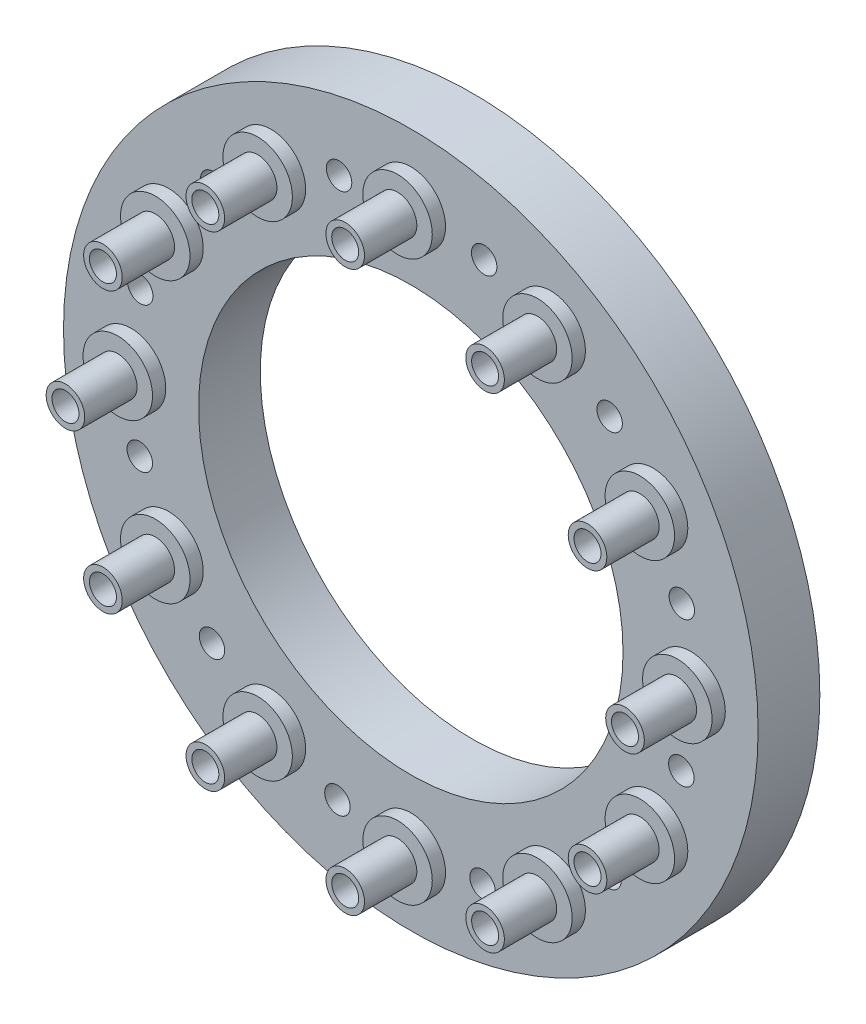
from build123d import *

# Parameters (mm, degrees)
SKETCH1_R            = 180
SKETCH1_R_2          = 110
BOTTOM_ANNULUS_DEPTH = 10
SKETCH3_R            = 180
SKETCH3_R_2          = 110
ANNULUS_PLENUM_DEPTH = 12
SKETCH4_R            = 180
SKETCH4_R_2          = 110
TOP_ANNULUS_DEPTH    = 10
SKETCH8_R            = 6.6
CUT_EXTRUDE1_DEPTH   = 75
SKETCH6_R            = 18
SKETCH6_R_2          = 10
BOSS_EXTRUDE6_DEPTH  = 6.871206759
SKETCH10_R           = 10
SKETCH10_R_2         = 7
BOSS_EXTRUDE7_DEPTH  = 33.989306272


with BuildPart() as part:
    # Sketch1 → Bottom Annulus (new body)
    with BuildSketch(Plane.XY):
        Circle(SKETCH1_R)
        Circle(SKETCH1_R_2, mode=Mode.SUBTRACT)
    extrude(amount=BOTTOM_ANNULUS_DEPTH)

    # Sketch3 → Annulus Plenum (add)
    with BuildSketch(Plane.XY.offset(10)):
        Circle(SKETCH3_R)
        Circle(SKETCH3_R_2, mode=Mode.SUBTRACT)
    extrude(amount=ANNULUS_PLENUM_DEPTH)

    # Sketch4 → Top annulus (add)
    with BuildSketch(Plane.XY.offset(22)):
        Circle(SKETCH4_R)
        Circle(SKETCH4_R_2, mode=Mode.SUBTRACT)
    extrude(amount=TOP_ANNULUS_DEPTH)

    # Sketch8 → Cut-Extrude1 (cut)
    with BuildSketch(Plane.XY.offset(32)):
        with Locations((-37.181108248, 140.450646422)):
            Circle(SKETCH8_R)
        with Locations((38.025538928, 140.224381904)):
            Circle(SKETCH8_R)
        with Locations((103.043273656, 102.425107495)):
            Circle(SKETCH8_R)
        with Locations((140.450646422, 37.181108248)):
            Circle(SKETCH8_R)
        with Locations((140.224381904, -38.025538928)):
            Circle(SKETCH8_R)
        with Locations((102.425107495, -103.043273656)):
            Circle(SKETCH8_R)
        with Locations((37.181108248, -140.450646422)):
            Circle(SKETCH8_R)
        with Locations((-38.025538928, -140.224381904)):
            Circle(SKETCH8_R)
        with Locations((-103.043273656, -102.425107495)):
            Circle(SKETCH8_R)
        with Locations((-140.450646422, -37.181108248)):
            Circle(SKETCH8_R)
        with Locations((-140.224381904, 38.025538928)):
            Circle(SKETCH8_R)
        with Locations((-102.425107495, 103.043273656)):
            Circle(SKETCH8_R)
    extrude(amount=-CUT_EXTRUDE1_DEPTH, mode=Mode.SUBTRACT)

    # Sketch6 → Boss-Extrude6 (add)
    # profile 1 of 12: a face of its own
    with BuildSketch(Plane.XY.offset(32)):
        with Locations((0, 145)):
            Circle(SKETCH6_R)
        with Locations((0, 145)):
            Circle(SKETCH6_R_2, mode=Mode.SUBTRACT)
    # profile 2 of 12: a face of its own
    with BuildSketch(Plane.XY.offset(32)):
        with Locations((72.5, 125.573683549)):
            Circle(SKETCH6_R)
        with Locations((72.5, 125.573683549)):
            Circle(SKETCH6_R_2, mode=Mode.SUBTRACT)
    # profile 3 of 12: a face of its own
    with BuildSketch(Plane.XY.offset(32)):
        with Locations((125.573683549, 72.5)):
            Circle(SKETCH6_R)
        with Locations((125.573683549, 72.5)):
            Circle(SKETCH6_R_2, mode=Mode.SUBTRACT)
    # profile 4 of 12: a face of its own
    with BuildSketch(Plane.XY.offset(32)):
        with Locations((145, 0)):
            Circle(SKETCH6_R)
        with Locations((145, 0)):
            Circle(SKETCH6_R_2, mode=Mode.SUBTRACT)
    # profile 5 of 12: a face of its own
    with BuildSketch(Plane.XY.offset(32)):
        with Locations((125.573683549, -72.5)):
            Circle(SKETCH6_R)
        with Locations((125.573683549, -72.5)):
            Circle(SKETCH6_R_2, mode=Mode.SUBTRACT)
    # profile 6 of 12: a face of its own
    with BuildSketch(Plane.XY.offset(32)):
        with Locations((72.5, -125.573683549)):
            Circle(SKETCH6_R)
        with Locations((72.5, -125.573683549)):
            Circle(SKETCH6_R_2, mode=Mode.SUBTRACT)
    # profile 7 of 12: a face of its own
    with BuildSketch(Plane.XY.offset(32)):
        with Locations((0, -145)):
            Circle(SKETCH6_R)
        with Locations((0, -145)):
            Circle(SKETCH6_R_2, mode=Mode.SUBTRACT)
    # profile 8 of 12: a face of its own
    with BuildSketch(Plane.XY.offset(32)):
        with Locations((-72.5, -125.573683549)):
            Circle(SKETCH6_R)
        with Locations((-72.5, -125.573683549)):
            Circle(SKETCH6_R_2, mode=Mode.SUBTRACT)
    # profile 9 of 12: a face of its own
    with BuildSketch(Plane.XY.offset(32)):
        with Locations((-125.573683549, -72.5)):
            Circle(SKETCH6_R)
        with Locations((-125.573683549, -72.5)):
            Circle(SKETCH6_R_2, mode=Mode.SUBTRACT)
    # profile 10 of 12: a face of its own
    with BuildSketch(Plane.XY.offset(32)):
        with Locations((-145, 0)):
            Circle(SKETCH6_R)
        with Locations((-145, 0)):
            Circle(SKETCH6_R_2, mode=Mode.SUBTRACT)
    # profile 11 of 12: a face of its own
    with BuildSketch(Plane.XY.offset(32)):
        with Locations((-125.573683549, 72.5)):
            Circle(SKETCH6_R)
        with Locations((-125.573683549, 72.5)):
            Circle(SKETCH6_R_2, mode=Mode.SUBTRACT)
    # profile 12 of 12: a face of its own
    with BuildSketch(Plane.XY.offset(32)):
        with Locations((-72.5, 125.573683549)):
            Circle(SKETCH6_R)
        with Locations((-72.5, 125.573683549)):
            Circle(SKETCH6_R_2, mode=Mode.SUBTRACT)
    extrude(amount=BOSS_EXTRUDE6_DEPTH)

    # Sketch10 → Boss-Extrude7 (add)
    # profile 1 of 12: a face of its own
    with BuildSketch(Plane.XY.offset(32)):
        with Locations((0, 145)):
            Circle(SKETCH10_R)
        with Locations((0, 145)):
            Circle(SKETCH10_R_2, mode=Mode.SUBTRACT)
    # profile 2 of 12: a face of its own
    with BuildSketch(Plane.XY.offset(32)):
        with Locations((72.5, 125.573683549)):
            Circle(SKETCH10_R)
        with Locations((72.5, 125.573683549)):
            Circle(SKETCH10_R_2, mode=Mode.SUBTRACT)
    # profile 3 of 12: a face of its own
    with BuildSketch(Plane.XY.offset(32)):
        with Locations((125.573683549, 72.5)):
            Circle(SKETCH10_R)
        with Locations((125.573683549, 72.5)):
            Circle(SKETCH10_R_2, mode=Mode.SUBTRACT)
    # profile 4 of 12: a face of its own
    with BuildSketch(Plane.XY.offset(32)):
        with Locations((145, 0)):
            Circle(SKETCH10_R)
        with Locations((145, 0)):
            Circle(SKETCH10_R_2, mode=Mode.SUBTRACT)
    # profile 5 of 12: a face of its own
    with BuildSketch(Plane.XY.offset(32)):
        with Locations((125.573683549, -72.5)):
            Circle(SKETCH10_R)
        with Locations((125.573683549, -72.5)):
            Circle(SKETCH10_R_2, mode=Mode.SUBTRACT)
    # profile 6 of 12: a face of its own
    with BuildSketch(Plane.XY.offset(32)):
        with Locations((72.5, -125.573683549)):
            Circle(SKETCH10_R)
        with Locations((72.5, -125.573683549)):
            Circle(SKETCH10_R_2, mode=Mode.SUBTRACT)
    # profile 7 of 12: a face of its own
    with BuildSketch(Plane.XY.offset(32)):
        with Locations((0, -145)):
            Circle(SKETCH10_R)
        with Locations((0, -145)):
            Circle(SKETCH10_R_2, mode=Mode.SUBTRACT)
    # profile 8 of 12: a face of its own
    with BuildSketch(Plane.XY.offset(32)):
        with Locations((-72.5, -125.573683549)):
            Circle(SKETCH10_R)
        with Locations((-72.5, -125.573683549)):
            Circle(SKETCH10_R_2, mode=Mode.SUBTRACT)
    # profile 9 of 12: a face of its own
    with BuildSketch(Plane.XY.offset(32)):
        with Locations((-125.573683549, -72.5)):
            Circle(SKETCH10_R)
        with Locations((-125.573683549, -72.5)):
            Circle(SKETCH10_R_2, mode=Mode.SUBTRACT)
    # profile 10 of 12: a face of its own
    with BuildSketch(Plane.XY.offset(32)):
        with Locations((-145, 0)):
            Circle(SKETCH10_R)
        with Locations((-145, 0)):
            Circle(SKETCH10_R_2, mode=Mode.SUBTRACT)
    # profile 11 of 12: a face of its own
    with BuildSketch(Plane.XY.offset(32)):
        with Locations((-125.573683549, 72.5)):
            Circle(SKETCH10_R)
        with Locations((-125.573683549, 72.5)):
            Circle(SKETCH10_R_2, mode=Mode.SUBTRACT)
    # profile 12 of 12: a face of its own
    with BuildSketch(Plane.XY.offset(32)):
        with Locations((-72.5, 125.573683549)):
            Circle(SKETCH10_R)
        with Locations((-72.5, 125.573683549)):
            Circle(SKETCH10_R_2, mode=Mode.SUBTRACT)
    extrude(amount=BOSS_EXTRUDE7_DEPTH)


solid = part.part
